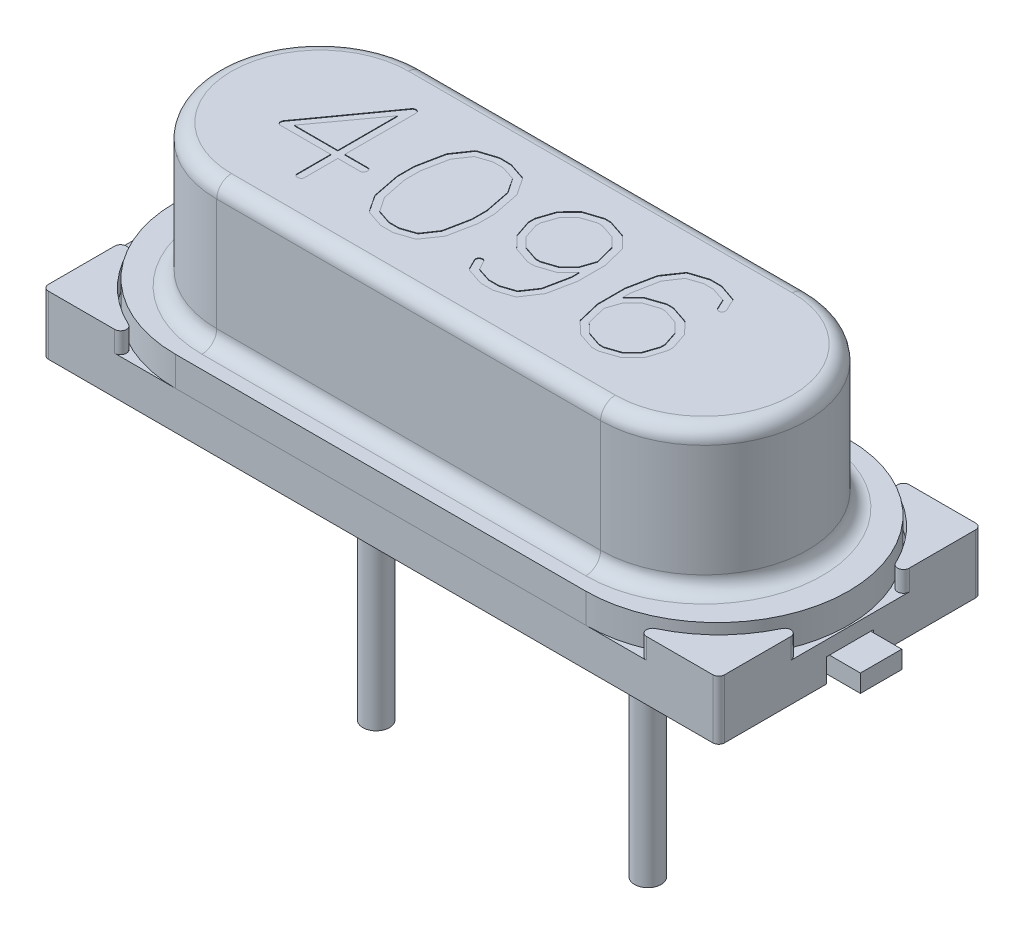
from build123d import *

# Parameters (mm, degrees)
SKETCH1_W             = 11.45
SKETCH1_H             = 4.45
BOSS_EXTRUDE1_DEPTH   = 1
CUT_EXTRUDE2_DEPTH    = 0.35
FILLET1_R             = 0.1
BOSS_EXTRUDE2_DEPTH   = 0.5
BOSS_EXTRUDE3_DEPTH   = 2.4
FILLET2_R             = 0.25
CUT_EXTRUDE3_DEPTH    = 0.01
SKETCH6_W             = 5.638304111
SKETCH6_H             = 0.8
CUT_EXTRUDE4_DEPTH    = 0.4
BOSS_EXTRUDE4_DEPTH   = 0.3
BOSS_EXTRUDE4_2_DEPTH = 0.3
SKETCH8_R             = 0.825
CUT_EXTRUDE5_DEPTH    = 0.01
SKETCH9_R             = 0.225
BOSS_EXTRUDE5_DEPTH   = 5.4
BOSS_EXTRUDE5_2_DEPTH = 5.4


with BuildPart() as part:
    # Sketch1 → Boss-Extrude1 (new body)
    with BuildSketch(Plane(origin=(0, 0, 0), x_dir=(1, 0, 0), z_dir=(0, 1, 0))):
        Rectangle(SKETCH1_W, SKETCH1_H)
    extrude(amount=-BOSS_EXTRUDE1_DEPTH)

    # Sketch2 → Cut-Extrude2 (cut)
    with BuildSketch(Plane(origin=(0, 0, 0), x_dir=(1, 0, 0), z_dir=(0, 1, 0))):
        with BuildLine():
            Line((-3.5, 2.25), (3.5, 2.25))
            ThreePointArc((3.5, 2.25), (5.75, 0), (3.5, -2.25))
            Line((3.5, -2.25), (-3.5, -2.25))
            ThreePointArc((-3.5, -2.25), (-5.75, 0), (-3.5, 2.25))
        make_face()
    extrude(amount=-CUT_EXTRUDE2_DEPTH, mode=Mode.SUBTRACT)

    # Fillet1
    fillet1_edges = [part.edges().sort_by_distance(p)[0] for p in [
        (-3.834477204, -0.175, 2.225),
        (-5.725, -0.175, 0.334477204),
        (-5.725, -0.175, -0.334477204),
        (-3.834477204, -0.175, -2.225),
        (5.725, -0.175, -0.334477204),
        (5.725, -0.175, 0.334477204),
        (3.834477204, -0.175, 2.225),
        (3.834477204, -0.175, -2.225),
        (5.725, -0.5, 2.225),
        (-5.725, -0.5, 2.225),
        (-5.725, -0.5, -2.225),
        (5.725, -0.5, -2.225),
    ]]
    fillet(fillet1_edges, radius=FILLET1_R)

    # Sketch6 → Cut-Extrude4 (cut)
    with BuildSketch(Plane.XZ.offset(1)):
        with Locations((-5.019152056, 0)):
            Rectangle(SKETCH6_W, SKETCH6_H)
        with Locations((5.019152056, 0)):
            Rectangle(SKETCH6_W, SKETCH6_H)
    extrude(amount=-CUT_EXTRUDE4_DEPTH, mode=Mode.SUBTRACT)


with BuildPart() as body_2:
    # Sketch3 → Boss-Extrude2 (new body)
    with BuildSketch(Plane(origin=(0, -0.35, 0), x_dir=(1, 0, 0), z_dir=(0, 1, 0))):
        with BuildLine():
            Line((-3.475, 2.225), (3.475, 2.225))
            ThreePointArc((3.475, 2.225), (5.7, 0), (3.475, -2.225))
            Line((3.475, -2.225), (-3.475, -2.225))
            ThreePointArc((-3.475, -2.225), (-5.7, 0), (-3.475, 2.225))
        make_face()
    extrude(amount=BOSS_EXTRUDE2_DEPTH)

    # Sketch4 → Boss-Extrude3 (add)
    with BuildSketch(Plane(origin=(0, 0.15, 0), x_dir=(1, 0, 0), z_dir=(0, 1, 0))):
        with BuildLine():
            Line((-3.25, 1.75), (3.25, 1.75))
            ThreePointArc((3.25, 1.75), (5, 0), (3.25, -1.75))
            Line((3.25, -1.75), (-3.25, -1.75))
            ThreePointArc((-3.25, -1.75), (-5, 0), (-3.25, 1.75))
        make_face()
    extrude(amount=BOSS_EXTRUDE3_DEPTH)

    # Fillet2
    fillet2_edges = [body_2.edges().sort_by_distance(p)[0] for p in [
        (-5, 0.15, 0),
        (0, 0.15, 1.75),
        (5, 0.15, 0),
        (0, 0.15, -1.75),
        (-5, 2.55, 0),
        (0, 2.55, 1.75),
        (5, 2.55, 0),
        (0, 2.55, -1.75),
    ]]
    fillet(fillet2_edges, radius=FILLET2_R)

    # Sketch5 → Cut-Extrude3 (cut)
    # profile 1 of 4: a face of its own
    with BuildSketch(Plane(origin=(0, 2.55, 0), x_dir=(1, 0, 0), z_dir=(0, 1, 0))):
        with BuildLine():
            Line((-2.579613095, 0.972619048), (-2.571428571, 0.95327381))
            Line((-2.571428571, 0.95327381), (-2.571428571, -0.25952381))
            Line((-2.571428571, -0.25952381), (-2.175223214, -0.25952381))
            add(Edge.make_bspline(
                [(-2.175223214, -0.25952381), (-2.169995179, -0.260915744), (-2.159866911, -0.263612336), (-2.147043033, -0.273515312), (-2.139062354, -0.288483231), (-2.136940041, -0.299856703), (-2.13578869, -0.306026786)],
                knots=[0, 0, 0, 0, 0.979500305, 1.897585042, 2.859444737, 4, 4, 4, 4], degree=3))
            add(Edge.make_bspline(
                [(-2.13578869, -0.306026786), (-2.135994016, -0.313261221), (-2.136370658, -0.326531767), (-2.141042701, -0.344658389), (-2.148002784, -0.359864656), (-2.155866006, -0.366747839), (-2.159598214, -0.370014881)],
                knots=[0, 0, 0, 0, 1.223484903, 2.24430974, 3.166677144, 4, 4, 4, 4], degree=3))
            Line((-2.159598214, -0.370014881), (-2.180803571, -0.378571429))
            Line((-2.180803571, -0.378571429), (-2.571428571, -0.378571429))
            Line((-2.571428571, -0.378571429), (-2.571428571, -0.95483631))
            add(Edge.make_bspline(
                [(-2.571428571, -0.95483631), (-2.572821885, -0.959041639), (-2.575457447, -0.96699635), (-2.582647799, -0.976721347), (-2.590272887, -0.985049969), (-2.602371768, -0.991127936), (-2.615813455, -0.996051261), (-2.626454806, -0.997153279), (-2.630952381, -0.997619048)],
                knots=[0, 0, 0, 0, 1.006492665, 1.903860076, 2.74662138, 3.559717469, 4.968612883, 6, 6, 6, 6], degree=3))
            add(Edge.make_bspline(
                [(-2.630952381, -0.997619048), (-2.639748579, -0.997268595), (-2.655523951, -0.996640081), (-2.675984291, -0.987122041), (-2.689025253, -0.970173205), (-2.689969578, -0.956559469), (-2.69047619, -0.949255952)],
                knots=[0, 0, 0, 0, 1.203198397, 2.157853217, 3.011722445, 4, 4, 4, 4], degree=3))
            Line((-2.69047619, -0.949255952), (-2.69047619, -0.378571429))
            Line((-2.69047619, -0.378571429), (-3.548735119, -0.378571429))
            add(Edge.make_bspline(
                [(-3.548735119, -0.378571429), (-3.55430374, -0.377268995), (-3.564889923, -0.374793013), (-3.578838909, -0.366107964), (-3.589139275, -0.353290948), (-3.593152992, -0.342996644), (-3.595238095, -0.33764881)],
                knots=[0, 0, 0, 0, 1.042993972, 1.982775231, 2.9520629, 4, 4, 4, 4], degree=3))
            Line((-3.595238095, -0.33764881), (-3.595238095, -0.321279762))
            add(Edge.make_bspline(
                [(-3.595238095, -0.321279762), (-3.59466811, -0.314029544), (-3.59350606, -0.29924824), (-3.585534653, -0.286733442), (-3.581473214, -0.280357143)],
                knots=[0, 0, 0, 0, 0.980998486, 2, 2, 2, 2], degree=3))
            Line((-3.581473214, -0.280357143), (-3.474330357, -0.133035714))
            Line((-3.474330357, -0.133035714), (-2.670386905, 0.986011905))
            add(Edge.make_bspline(
                [(-2.670386905, 0.986011905), (-2.663572924, 0.990774378), (-2.651057582, 0.999521684), (-2.635966844, 1.001486075), (-2.629092262, 1.002380952)],
                knots=[0, 0, 0, 0, 1.088900487, 2, 2, 2, 2], degree=3))
            add(Edge.make_bspline(
                [(-2.629092262, 1.002380952), (-2.627723952, 1.002151946), (-2.623951151, 1.001520512), (-2.620274659, 1.000455526), (-2.617931548, 0.999776786)],
                knots=[0, 0, 0, 0, 0.725354991, 2, 2, 2, 2], degree=3))
            add(Edge.make_bspline(
                [(-2.617931548, 0.999776786), (-2.613257185, 0.998777727), (-2.604543442, 0.996915324), (-2.59339972, 0.99067786), (-2.584652077, 0.982739104), (-2.58128538, 0.975977587), (-2.579613095, 0.972619048)],
                knots=[0, 0, 0, 0, 1.162506102, 2.167093341, 3.089569625, 4, 4, 4, 4], degree=3))
        make_face()
        Polygon((-3.427083333, -0.25952381), (-2.69047619, -0.25952381), (-2.69047619, 0.753497024), align=None, mode=Mode.SUBTRACT)
    # profile 2 of 4: a face of its own
    with BuildSketch(Plane(origin=(0, 2.55, 0), x_dir=(1, 0, 0), z_dir=(0, 1, 0))):
        with BuildLine():
            add(Edge.make_bspline(
                [(-1.012276786, 0.999776786), (-1.003964468, 0.996935625), (-0.986337607, 0.990910741), (-0.958512879, 0.981137184), (-0.927443458, 0.970794037), (-0.89340553, 0.959193318), (-0.856114547, 0.947058565), (-0.816022517, 0.933528467), (-0.772682568, 0.919452629), (-0.742804424, 0.909632446), (-0.727306548, 0.90453869)],
                knots=[0, 0, 0, 0, 0.701660968, 1.487921959, 2.355571994, 3.317190182, 4.360247517, 5.487871983, 6.696952224, 8, 8, 8, 8], degree=3))
            Line((-0.727306548, 0.90453869), (-0.70796131, 0.885565476))
            Line((-0.70796131, 0.885565476), (-0.524553571, 0.608779762))
            Line((-0.524553571, 0.608779762), (-0.518973214, 0.592782738))
            Line((-0.518973214, 0.592782738), (-0.428571429, 0.136681548))
            Line((-0.428571429, 0.136681548), (-0.428571429, -0.145684524))
            Line((-0.428571429, -0.145684524), (-0.518973214, -0.60141369))
            Line((-0.518973214, -0.60141369), (-0.530133929, -0.620386905))
            Line((-0.530133929, -0.620386905), (-0.716145833, -0.891964286))
            Line((-0.716145833, -0.891964286), (-0.729910714, -0.902752976))
            add(Edge.make_bspline(
                [(-0.729910714, -0.902752976), (-0.739105416, -0.90529657), (-0.759452591, -0.91092535), (-0.792553647, -0.921670526), (-0.831508112, -0.934021625), (-0.873869304, -0.948928774), (-0.916129037, -0.963513835), (-0.954424903, -0.976363851), (-0.986619972, -0.987662057), (-1.00607699, -0.99451721), (-1.014880952, -0.997619048)],
                knots=[0, 0, 0, 0, 0.762114036, 1.68650047, 2.779979974, 4.027002159, 5.274024345, 6.35181635, 7.254225619, 8, 8, 8, 8], degree=3))
            Line((-1.014880952, -0.997619048), (-1.225818452, -0.997619048))
            add(Edge.make_bspline(
                [(-1.225818452, -0.997619048), (-1.234239994, -0.994856453), (-1.252165173, -0.988976294), (-1.280760187, -0.980413698), (-1.311828887, -0.969685735), (-1.346068497, -0.958691031), (-1.382985462, -0.945808849), (-1.423245207, -0.932773285), (-1.46595139, -0.917552791), (-1.495521258, -0.907547076), (-1.51078869, -0.902380952)],
                knots=[0, 0, 0, 0, 0.707906692, 1.506773219, 2.383791417, 3.332855564, 4.379031741, 5.506626567, 6.71262828, 8, 8, 8, 8], degree=3))
            Line((-1.51078869, -0.902380952), (-1.530133929, -0.886383929))
            Line((-1.530133929, -0.886383929), (-1.713541667, -0.608854167))
            Line((-1.713541667, -0.608854167), (-1.719122024, -0.592857143))
            Line((-1.719122024, -0.592857143), (-1.80952381, -0.136383929))
            Line((-1.80952381, -0.136383929), (-1.80952381, 0.151934524))
            Line((-1.80952381, 0.151934524), (-1.719122024, 0.605803571))
            Line((-1.719122024, 0.605803571), (-1.7109375, 0.621800595))
            Line((-1.7109375, 0.621800595), (-1.524553571, 0.89375))
            Line((-1.524553571, 0.89375), (-1.508184524, 0.907142857))
            add(Edge.make_bspline(
                [(-1.508184524, 0.907142857), (-1.498875926, 0.909844311), (-1.478228109, 0.915836527), (-1.444290808, 0.926394155), (-1.404215322, 0.938977638), (-1.360062712, 0.953225751), (-1.315950763, 0.967842214), (-1.275947101, 0.981264378), (-1.241917137, 0.992392912), (-1.221351051, 0.999271357), (-1.212053571, 1.002380952)],
                knots=[0, 0, 0, 0, 0.747758559, 1.658636604, 2.741865765, 3.988370732, 5.237845973, 6.326973741, 7.243661272, 8, 8, 8, 8], degree=3))
            Line((-1.212053571, 1.002380952), (-1.012276786, 0.999776786))
        make_face()
        Polygon((-0.797991071, 0.807440476), (-1.031994048, 0.883333333), (-1.20610119, 0.883333333), (-1.442708333, 0.80483631), (-1.606026786, 0.564136905), (-1.69047619, 0.141889881), (-1.69047619, -0.126339286), (-1.603422619, -0.55639881), (-1.440104167, -0.800074405), (-1.20610119, -0.878571429), (-1.034598214, -0.878571429), (-0.795386905, -0.797470238), (-0.632068452, -0.55639881), (-0.547619048, -0.131547619), (-0.547619048, 0.125520833), (-0.634672619, 0.564136905), align=None, mode=Mode.SUBTRACT)
    # profile 3 of 4: a face of its own
    with BuildSketch(Plane(origin=(0, 2.55, 0), x_dir=(1, 0, 0), z_dir=(0, 1, 0))):
        with BuildLine():
            add(Edge.make_bspline(
                [(0.962425595, 0.90453869), (0.973578842, 0.893742297), (0.995129407, 0.87288125), (1.026378173, 0.84287388), (1.055116382, 0.814815594), (1.081575356, 0.7889411), (1.105259046, 0.764634107), (1.126975653, 0.742697373), (1.146220935, 0.722751358), (1.158125856, 0.70998509), (1.163690476, 0.704017857)],
                knots=[0, 0, 0, 0, 1.311123651, 2.533384019, 3.659256471, 4.703587179, 5.659043355, 6.525625502, 7.31084517, 8, 8, 8, 8], degree=3))
            add(Edge.make_bspline(
                [(1.163690476, 0.704017857), (1.165371633, 0.695289732), (1.169295671, 0.674917155), (1.176144758, 0.655322077), (1.180059524, 0.644122024)],
                knots=[0, 0, 0, 0, 0.856850361, 2, 2, 2, 2], degree=3))
            Line((1.180059524, 0.644122024), (1.261904762, 0.315997024))
            Line((1.261904762, 0.315997024), (1.261904762, -0.14828869))
            Line((1.261904762, -0.14828869), (1.169270833, -0.604017857))
            Line((1.169270833, -0.604017857), (1.155505952, -0.622991071))
            Line((1.155505952, -0.622991071), (0.975818452, -0.894568452))
            Line((0.975818452, -0.894568452), (0.953869048, -0.90796131))
            add(Edge.make_bspline(
                [(0.953869048, -0.90796131), (0.945681027, -0.910554581), (0.928296062, -0.916060665), (0.90066801, -0.925069568), (0.870052189, -0.935033396), (0.836473055, -0.945907707), (0.799933077, -0.957308115), (0.760484375, -0.970178873), (0.717822109, -0.98329308), (0.688480952, -0.992747641), (0.673363095, -0.997619048)],
                knots=[0, 0, 0, 0, 0.699967742, 1.486185097, 2.368276625, 3.32389879, 4.362689166, 5.487718558, 6.70556191, 8, 8, 8, 8], degree=3))
            Line((0.673363095, -0.997619048), (0.466145833, -0.997619048))
            add(Edge.make_bspline(
                [(0.466145833, -0.997619048), (0.45795865, -0.995023221), (0.440575464, -0.989511711), (0.413044303, -0.980585582), (0.382719814, -0.970490126), (0.349250342, -0.959789889), (0.313169739, -0.947371827), (0.273929176, -0.934627981), (0.232235289, -0.919720468), (0.203266896, -0.910017187), (0.188244048, -0.904985119)],
                knots=[0, 0, 0, 0, 0.703658691, 1.494021792, 2.37110896, 3.322105247, 4.372680049, 5.497143234, 6.702032305, 8, 8, 8, 8], degree=3))
            add(Edge.make_bspline(
                [(0.188244048, -0.904985119), (0.186860413, -0.904144912), (0.18313973, -0.90188554), (0.176850475, -0.89642264), (0.16850803, -0.888137841), (0.161856314, -0.882018048), (0.158110119, -0.878571429)],
                knots=[0, 0, 0, 0, 0.483237896, 1.299458199, 2.479075808, 4, 4, 4, 4], degree=3))
            Line((0.158110119, -0.878571429), (0.06547619, -0.693303571))
            add(Edge.make_bspline(
                [(0.06547619, -0.693303571), (0.065703271, -0.687063484), (0.066142404, -0.674996282), (0.07109764, -0.658335059), (0.078654854, -0.6435747), (0.086204879, -0.636085657), (0.090029762, -0.632291667)],
                knots=[0, 0, 0, 0, 1.100929796, 2.128999637, 3.052141028, 4, 4, 4, 4], degree=3))
            add(Edge.make_bspline(
                [(0.090029762, -0.632291667), (0.099405554, -0.629982552), (0.115448298, -0.62603147), (0.131919764, -0.624934881), (0.138764881, -0.624479167)],
                knots=[0, 0, 0, 0, 1.168851538, 2, 2, 2, 2], degree=3))
            add(Edge.make_bspline(
                [(0.138764881, -0.624479167), (0.142936465, -0.62632332), (0.150863421, -0.62982763), (0.161015598, -0.637039299), (0.169398585, -0.645214619), (0.172553133, -0.652009711), (0.174107143, -0.655357143)],
                knots=[0, 0, 0, 0, 1.131634214, 2.150362058, 3.088822117, 4, 4, 4, 4], degree=3))
            Line((0.174107143, -0.655357143), (0.255208333, -0.804166667))
            Line((0.255208333, -0.804166667), (0.485863095, -0.878571429))
            Line((0.485863095, -0.878571429), (0.659598214, -0.878571429))
            Line((0.659598214, -0.878571429), (0.892857143, -0.801190476))
            Line((0.892857143, -0.801190476), (1.058407738, -0.558258929))
            Line((1.058407738, -0.558258929), (1.145089286, -0.134151786))
            add(Edge.make_bspline(
                [(1.145089286, -0.134151786), (1.145120383, -0.121254795), (1.145178392, -0.097196258), (1.14480865, -0.063836094), (1.144171776, -0.035800958), (1.143264344, -0.018946985), (1.142857143, -0.011383929)],
                knots=[0, 0, 0, 0, 1.260201485, 2.350827779, 3.259949999, 4, 4, 4, 4], degree=3))
            Line((1.142857143, -0.011383929), (0.9609375, -0.193303571))
            add(Edge.make_bspline(
                [(0.9609375, -0.193303571), (0.951891401, -0.196299634), (0.93171404, -0.202982363), (0.898348244, -0.213492256), (0.859245341, -0.226900423), (0.815952106, -0.240486916), (0.772820856, -0.254199003), (0.734208434, -0.267578719), (0.701482528, -0.277922826), (0.682024466, -0.28501341), (0.673363095, -0.288169643)],
                knots=[0, 0, 0, 0, 0.755214709, 1.684509572, 2.772258172, 4.031034614, 5.280453424, 6.358882943, 7.269489218, 8, 8, 8, 8], degree=3))
            add(Edge.make_bspline(
                [(0.673363095, -0.288169643), (0.668648491, -0.28838484), (0.656844638, -0.288923626), (0.64508408, -0.290079566), (0.638020833, -0.29077381)],
                knots=[0, 0, 0, 0, 0.798824536, 2, 2, 2, 2], degree=3))
            add(Edge.make_bspline(
                [(0.638020833, -0.29077381), (0.631572421, -0.29077381), (0.619915675, -0.29077381), (0.608258929, -0.29077381), (0.603050595, -0.29077381)],
                knots=[0, 0, 0, 0, 1.106382979, 2, 2, 2, 2], degree=3))
            add(Edge.make_bspline(
                [(0.603050595, -0.29077381), (0.595104797, -0.290377711), (0.57604698, -0.289427679), (0.55714949, -0.286752984), (0.546130952, -0.285193452)],
                knots=[0, 0, 0, 0, 0.833862317, 2, 2, 2, 2], degree=3))
            add(Edge.make_bspline(
                [(0.546130952, -0.285193452), (0.525202067, -0.277670808), (0.4820932, -0.262175826), (0.415139374, -0.239921366), (0.344904579, -0.215757287), (0.296653463, -0.200168694), (0.271949405, -0.1921875)],
                knots=[0, 0, 0, 0, 0.921700048, 1.898497955, 2.924053307, 4, 4, 4, 4], degree=3))
            add(Edge.make_bspline(
                [(0.271949405, -0.1921875), (0.265980826, -0.186375488), (0.253352939, -0.174078854), (0.233657073, -0.154214793), (0.211700422, -0.132396254), (0.187907786, -0.108196135), (0.162359773, -0.081788006), (0.134583348, -0.053385188), (0.104960495, -0.022615726), (0.08456423, -0.001224042), (0.074032738, 0.009821429)],
                knots=[0, 0, 0, 0, 0.706943354, 1.495699609, 2.373749025, 3.333679347, 4.375539188, 5.49180291, 6.704907092, 8, 8, 8, 8], degree=3))
            Line((0.074032738, 0.009821429), (-0.023809524, 0.299627976))
            Line((-0.023809524, 0.299627976), (-0.023809524, 0.411979167))
            Line((-0.023809524, 0.411979167), (0.071428571, 0.698809524))
            add(Edge.make_bspline(
                [(0.071428571, 0.698809524), (0.077254657, 0.704888109), (0.08951346, 0.717678203), (0.109102737, 0.738019441), (0.130814287, 0.760455115), (0.154624264, 0.785008271), (0.180536373, 0.811675415), (0.208570934, 0.840436745), (0.2388245, 0.871443013), (0.259670493, 0.892760013), (0.27046131, 0.903794643)],
                knots=[0, 0, 0, 0, 0.707255945, 1.488153929, 2.372154819, 3.32980278, 4.361099159, 5.49550509, 6.7035617, 8, 8, 8, 8], degree=3))
            Line((0.27046131, 0.903794643), (0.572916667, 1.002380952))
            Line((0.572916667, 1.002380952), (0.676339286, 0.999776786))
            Line((0.676339286, 0.999776786), (0.962425595, 0.90453869))
        make_face()
        Polygon((0.901041667, 0.791443452), (0.659598214, 0.872916667), (0.575520833, 0.875520833), (0.331473214, 0.794047619), (0.174107143, 0.634077381), (0.092633929, 0.395238095), (0.090029762, 0.314136905), (0.171502976, 0.067113095), (0.331473214, -0.092857143), (0.575520833, -0.174330357), (0.65141369, -0.174330357), (0.8984375, -0.092857143), (1.058407738, 0.067113095), (1.139880952, 0.308556548), (1.055803571, 0.634077381), align=None, mode=Mode.SUBTRACT)
    # profile 4 of 4: a face of its own
    with BuildSketch(Plane(origin=(0, 2.55, 0), x_dir=(1, 0, 0), z_dir=(0, 1, 0))):
        with BuildLine():
            add(Edge.make_bspline(
                [(2.553943452, 0.999776786), (2.562133496, 0.997064958), (2.579407348, 0.991345367), (2.606764634, 0.981901241), (2.636991562, 0.97151811), (2.670262207, 0.960575002), (2.706006841, 0.947546506), (2.744896447, 0.934367576), (2.786791043, 0.920285656), (2.815489476, 0.910157673), (2.830357143, 0.904910714)],
                knots=[0, 0, 0, 0, 0.708495826, 1.494308503, 2.376731357, 3.333206145, 4.370366408, 5.500780582, 6.705240708, 8, 8, 8, 8], degree=3))
            add(Edge.make_bspline(
                [(2.830357143, 0.904910714), (2.83651013, 0.901512853), (2.849462084, 0.894360403), (2.856450543, 0.8812742), (2.860119048, 0.874404762)],
                knots=[0, 0, 0, 0, 0.950124999, 2, 2, 2, 2], degree=3))
            add(Edge.make_bspline(
                [(2.860119048, 0.874404762), (2.862488033, 0.868705193), (2.866651325, 0.858688683), (2.871778134, 0.845935014), (2.874954354, 0.837641247), (2.876126553, 0.833609567), (2.876488095, 0.832366071)],
                knots=[0, 0, 0, 0, 1.64099522, 2.883909998, 3.655762989, 4, 4, 4, 4], degree=3))
            Line((2.876488095, 0.832366071), (2.949776786, 0.685044643))
            add(Edge.make_bspline(
                [(2.949776786, 0.685044643), (2.949765458, 0.678335971), (2.949745282, 0.666386733), (2.948313817, 0.650884512), (2.94629959, 0.639364629), (2.942957175, 0.634025523), (2.941592262, 0.631845238)],
                knots=[0, 0, 0, 0, 1.473414105, 2.62439101, 3.438254585, 4, 4, 4, 4], degree=3))
            add(Edge.make_bspline(
                [(2.941592262, 0.631845238), (2.938811118, 0.62805502), (2.933324442, 0.620577628), (2.921656955, 0.612744649), (2.908164499, 0.607514406), (2.898368049, 0.607124286), (2.893229167, 0.606919643)],
                knots=[0, 0, 0, 0, 0.985461084, 1.944130654, 2.921561274, 4, 4, 4, 4], degree=3))
            add(Edge.make_bspline(
                [(2.893229167, 0.606919643), (2.888727502, 0.607346876), (2.883204484, 0.607871042), (2.877850258, 0.609265869), (2.876860119, 0.60952381)],
                knots=[0, 0, 0, 0, 1.630146534, 2, 2, 2, 2], degree=3))
            add(Edge.make_bspline(
                [(2.876860119, 0.60952381), (2.875092267, 0.610467697), (2.870670372, 0.612828626), (2.863755602, 0.618729545), (2.854687521, 0.627017476), (2.848177471, 0.633664609), (2.844494048, 0.637425595)],
                knots=[0, 0, 0, 0, 0.559315808, 1.399006286, 2.528342755, 4, 4, 4, 4], degree=3))
            Line((2.844494048, 0.637425595), (2.766369048, 0.803348214))
            Line((2.766369048, 0.803348214), (2.53125, 0.883333333))
            Line((2.53125, 0.883333333), (2.361235119, 0.883333333))
            Line((2.361235119, 0.883333333), (2.129092262, 0.804092262))
            Line((2.129092262, 0.804092262), (1.964657738, 0.5578125))
            Line((1.964657738, 0.5578125), (1.880952381, 0.119940476))
            Line((1.880952381, 0.119940476), (1.880952381, -0.003199405))
            Line((1.880952381, -0.003199405), (2.061755952, 0.175744048))
            add(Edge.make_bspline(
                [(2.061755952, 0.175744048), (2.070184643, 0.178484162), (2.087900123, 0.184243353), (2.11613889, 0.193145735), (2.147379386, 0.203600142), (2.181636818, 0.215528199), (2.219016761, 0.228144322), (2.259357634, 0.241923798), (2.302709448, 0.257200199), (2.332712933, 0.267759042), (2.348214286, 0.273214286)],
                knots=[0, 0, 0, 0, 0.70293754, 1.477438854, 2.348300821, 3.315624652, 4.354457194, 5.477285858, 6.69663542, 8, 8, 8, 8], degree=3))
            Line((2.348214286, 0.273214286), (2.410342262, 0.273214286))
            add(Edge.make_bspline(
                [(2.410342262, 0.273214286), (2.417782101, 0.273100743), (2.431302024, 0.27289441), (2.449582325, 0.272475435), (2.463773486, 0.270699411), (2.471736601, 0.268801484), (2.475074405, 0.268005952)],
                knots=[0, 0, 0, 0, 1.371342405, 2.492048891, 3.367930168, 4, 4, 4, 4], degree=3))
            Line((2.475074405, 0.268005952), (2.7421875, 0.179092262))
            Line((2.7421875, 0.179092262), (2.758556548, 0.168303571))
            Line((2.758556548, 0.168303571), (2.941964286, -0.017708333))
            Line((2.941964286, -0.017708333), (2.95014881, -0.033705357))
            add(Edge.make_bspline(
                [(2.95014881, -0.033705357), (2.958204253, -0.05826053), (2.973875016, -0.106029261), (2.996903405, -0.17594237), (3.019588514, -0.242002747), (3.034694209, -0.28483127), (3.04203869, -0.305654762)],
                knots=[0, 0, 0, 0, 1.080294536, 2.101565233, 3.076969305, 4, 4, 4, 4], degree=3))
            Line((3.04203869, -0.305654762), (3.04203869, -0.375595238))
            add(Edge.make_bspline(
                [(3.04203869, -0.375595238), (3.041649119, -0.381312681), (3.040710161, -0.395093023), (3.035790524, -0.418953419), (3.027648756, -0.4494406), (3.017408368, -0.487150974), (3.003419464, -0.531575847), (2.986726854, -0.583101106), (2.966478098, -0.641250184), (2.952134299, -0.682391612), (2.944568452, -0.704092262)],
                knots=[0, 0, 0, 0, 0.400280443, 0.964767126, 1.698569089, 2.607165052, 3.695776378, 4.954101113, 6.39339596, 8, 8, 8, 8], degree=3))
            add(Edge.make_bspline(
                [(2.944568452, -0.704092262), (2.930652649, -0.719066855), (2.901454274, -0.750486801), (2.853644706, -0.797829638), (2.800844115, -0.848604742), (2.763234145, -0.88275925), (2.743675595, -0.900520833)],
                knots=[0, 0, 0, 0, 0.872684822, 1.831082082, 2.872083978, 4, 4, 4, 4], degree=3))
            add(Edge.make_bspline(
                [(2.743675595, -0.900520833), (2.694914201, -0.917923638), (2.599611715, -0.951936829), (2.503189233, -0.982629999), (2.45610119, -0.997619048)],
                knots=[0, 0, 0, 0, 1.02329743, 2, 2, 2, 2], degree=3))
            Line((2.45610119, -0.997619048), (2.344866071, -0.997619048))
            add(Edge.make_bspline(
                [(2.344866071, -0.997619048), (2.335823456, -0.994489158), (2.315922592, -0.98760094), (2.282923985, -0.976971936), (2.24459889, -0.963847282), (2.202384451, -0.94998968), (2.160261506, -0.936228063), (2.122097336, -0.922994654), (2.08928337, -0.912308378), (2.069318918, -0.905733676), (2.060267857, -0.902752976)],
                knots=[0, 0, 0, 0, 0.765508866, 1.684721447, 2.7733434, 4.006277222, 5.239211044, 6.318435038, 7.237647619, 8, 8, 8, 8], degree=3))
            add(Edge.make_bspline(
                [(2.060267857, -0.902752976), (2.05433155, -0.896908058), (2.041770761, -0.884540641), (2.021557534, -0.86532646), (1.999642229, -0.843586429), (1.975554227, -0.819932197), (1.949410784, -0.794115978), (1.921136182, -0.766339812), (1.891012953, -0.736070272), (1.870169125, -0.715247505), (1.859375, -0.704464286)],
                knots=[0, 0, 0, 0, 0.708307873, 1.498727217, 2.371047817, 3.332830965, 4.369166627, 5.494965671, 6.702750079, 8, 8, 8, 8], degree=3))
            Line((1.859375, -0.704464286), (1.8515625, -0.688095238))
            Line((1.8515625, -0.688095238), (1.761904762, -0.313839286))
            Line((1.761904762, -0.313839286), (1.761904762, 0.153050595))
            Line((1.761904762, 0.153050595), (1.854166667, 0.606175595))
            Line((1.854166667, 0.606175595), (1.86235119, 0.622544643))
            Line((1.86235119, 0.622544643), (2.046502976, 0.89375))
            Line((2.046502976, 0.89375), (2.062872024, 0.907514881))
            add(Edge.make_bspline(
                [(2.062872024, 0.907514881), (2.072063675, 0.910068127), (2.092518142, 0.915749944), (2.125905181, 0.926375205), (2.16545259, 0.93905472), (2.209135682, 0.953221114), (2.252881236, 0.967820015), (2.292603465, 0.981341427), (2.326437787, 0.992313793), (2.346856785, 0.999261014), (2.356026786, 1.002380952)],
                knots=[0, 0, 0, 0, 0.74292943, 1.653264037, 2.728410129, 3.977609534, 5.229829531, 6.320181464, 7.245607624, 8, 8, 8, 8], degree=3))
            Line((2.356026786, 1.002380952), (2.553943452, 0.999776786))
        make_face()
        Polygon((2.684895833, 0.075297619), (2.443824405, 0.156770833), (2.365327381, 0.156770833), (2.119047619, 0.075297619), (1.962053571, -0.084672619), (1.880952381, -0.326116071), (1.962053571, -0.654241071), (2.119047619, -0.809002976), (2.360119048, -0.89047619), (2.441220238, -0.893080357), (2.684895833, -0.811607143), (2.844494048, -0.651636905), (2.925595238, -0.407589286), (2.925595238, -0.331696429), (2.844494048, -0.084672619), align=None, mode=Mode.SUBTRACT)
    extrude(amount=-CUT_EXTRUDE3_DEPTH, mode=Mode.SUBTRACT)

    # Sketch8 → Cut-Extrude5 (cut)
    with BuildSketch(Plane.XZ.offset(0.35)):
        with Locations(Location((2.3, 0, 0), (0, 0, 270))):
            Circle(SKETCH8_R)
        with Locations(Location((-2.3, 0, 0), (0, 0, 270))):
            Circle(SKETCH8_R)
    extrude(amount=-CUT_EXTRUDE5_DEPTH, mode=Mode.SUBTRACT)


with BuildPart() as body_3:
    # Sketch7 → Boss-Extrude4 (new body)
    with BuildSketch(Plane.XZ.offset(0.6)):
        Polygon((5.675, 0.35), (6.25, 0.35), (6.25, -0.35), (5.675, -0.35), (2.25, -0.35), (2.25, 0.35), align=None)
    extrude(amount=BOSS_EXTRUDE4_DEPTH)


with BuildPart() as body_4:
    # Sketch7 → Boss-Extrude4 2 (new body)
    with BuildSketch(Plane.XZ.offset(0.6)):
        Polygon((-5.675, 0.35), (-6.25, 0.35), (-6.25, -0.35), (-5.675, -0.35), (-2.25, -0.35), (-2.25, 0.35), align=None)
    extrude(amount=BOSS_EXTRUDE4_2_DEPTH)


with BuildPart() as body_5:
    # Sketch9 → Boss-Extrude5 (new body)
    with BuildSketch(Plane.XZ.offset(0.34)):
        with Locations(Location((2.3, 0, 0), (0, 0, 270))):
            Circle(SKETCH9_R)
    extrude(amount=BOSS_EXTRUDE5_DEPTH)


with BuildPart() as body_6:
    # Sketch9 → Boss-Extrude5 2 (new body)
    with BuildSketch(Plane.XZ.offset(0.34)):
        with Locations(Location((-2.3, 0, 0), (0, 0, 90))):
            Circle(SKETCH9_R)
    extrude(amount=BOSS_EXTRUDE5_2_DEPTH)


solid = Compound([part.part, body_2.part, body_3.part, body_4.part, body_5.part, body_6.part])
